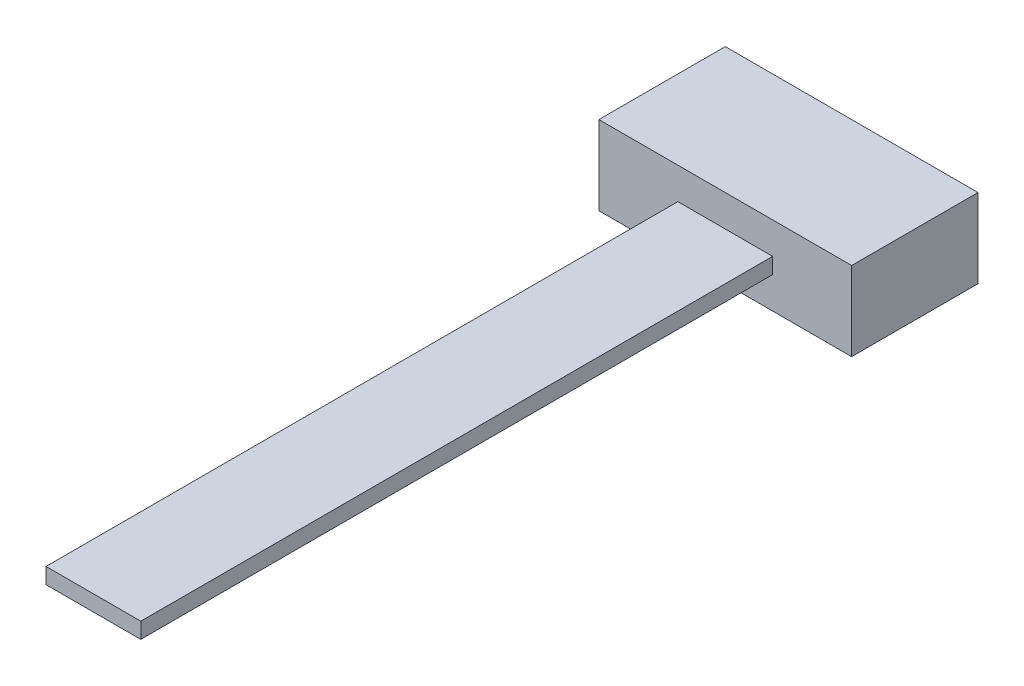
from build123d import *

# Parameters (mm, degrees)
SKETCH1_W           = 30
SKETCH1_H           = 5
BOSS_EXTRUDE1_DEPTH = 200
SKETCH2_W           = 80
SKETCH2_H           = 25
BOSS_EXTRUDE2_DEPTH = 40


with BuildPart() as part:
    # Sketch1 → Boss-Extrude1 (new body)
    with BuildSketch(Plane.XY):
        Rectangle(SKETCH1_W, SKETCH1_H)
    extrude(amount=BOSS_EXTRUDE1_DEPTH)

    # Sketch2 → Boss-Extrude2 (add)
    with BuildSketch(Plane.XY):
        Rectangle(SKETCH2_W, SKETCH2_H)
    extrude(amount=-BOSS_EXTRUDE2_DEPTH)


solid = part.part
